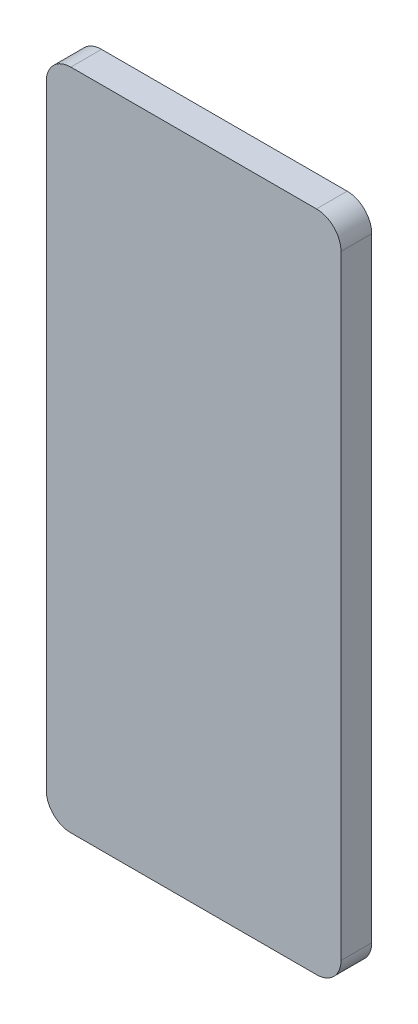
from build123d import *

# Parameters (mm, degrees)
BOSS_EXTRUDE1_DEPTH = 5


with BuildPart() as part:
    # Sketch1 → Boss-Extrude1 (new body)
    with BuildSketch(Plane.XY):
        with BuildLine():
            Line((-20, -54), (20, -54))
            ThreePointArc((20, -54), (22.828427125, -52.828427125), (24, -50))
            Line((24, -50), (24, 50))
            ThreePointArc((24, 50), (22.828427125, 52.828427125), (20, 54))
            Line((20, 54), (-20, 54))
            ThreePointArc((-20, 54), (-22.828427125, 52.828427125), (-24, 50))
            Line((-24, 50), (-24, -50))
            ThreePointArc((-24, -50), (-22.828427125, -52.828427125), (-20, -54))
        make_face()
    extrude(amount=-BOSS_EXTRUDE1_DEPTH)


solid = part.part
